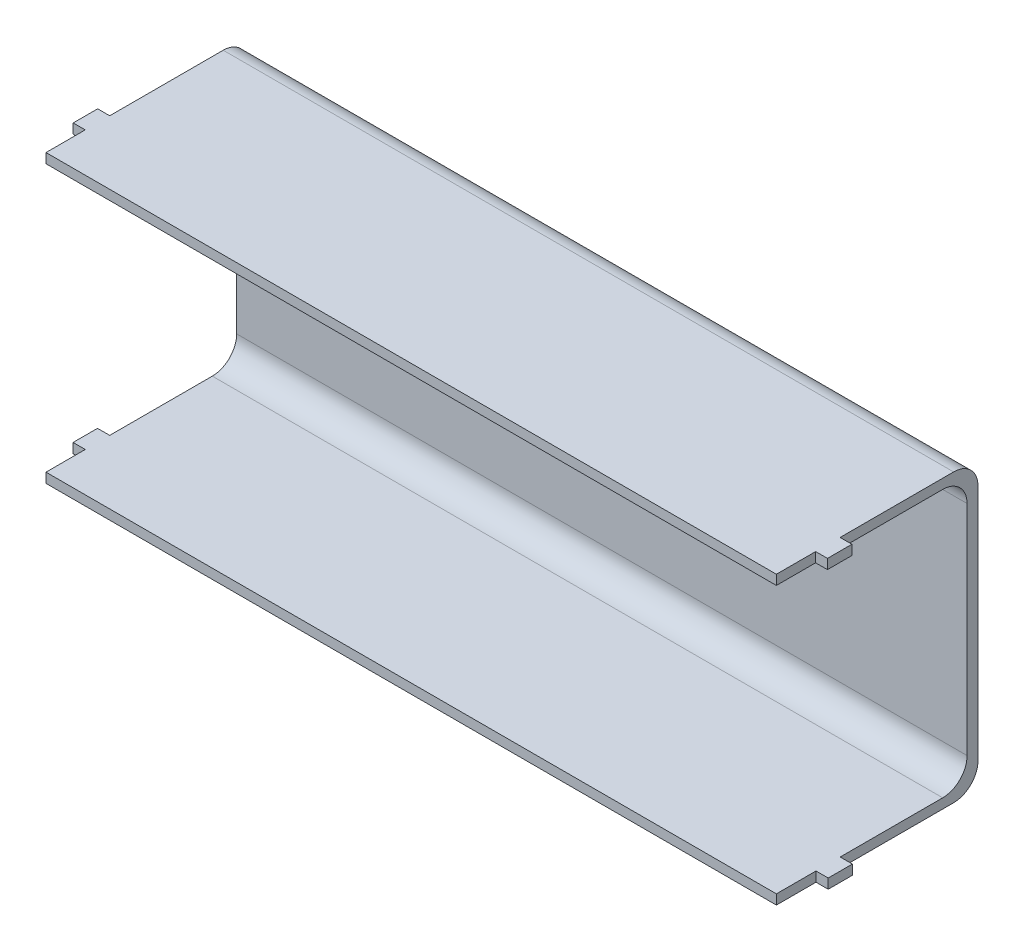
from build123d import *

# Parameters (mm, degrees)
BOSS_EXTRUDE1_DEPTH = 152.146
SKETCH2_W           = 2.509536254
SKETCH2_H           = 5.091968042
SKETCH2_W_2         = 2.457399938
BOSS_EXTRUDE2_DEPTH = 2.032
SKETCH3_W           = 5.037993656
SKETCH3_H           = 2.032
BOSS_EXTRUDE3_DEPTH = 2.54
SKETCH4_W           = 5.091968042
SKETCH4_H           = 2.032
BOSS_EXTRUDE4_DEPTH = 2.54


with BuildPart() as part:
    # Sketch1 → Boss-Extrude1 (new body)
    with BuildSketch(Plane(origin=(0, 0, 0), x_dir=(0, 0, -1), z_dir=(1, 0, 0))):
        with BuildLine():
            Line((0, 42.142112298), (36.917745163, 42.142112298))
            ThreePointArc((36.917745163, 42.142112298), (40.509847611, 40.654214746), (41.997745163, 37.062112298))
            Line((41.997745163, 37.062112298), (41.997745163, -12.467887702))
            ThreePointArc((41.997745163, -12.467887702), (40.509847611, -16.05999015), (36.917745163, -17.547887702))
            Line((36.917745163, -17.547887702), (0, -17.547887702))
            Line((0, -17.547887702), (0, -15.515887702))
            Line((0, -15.515887702), (34.644615501, -15.515887702))
            ThreePointArc((34.644615501, -15.515887702), (38.23671795, -14.02799015), (39.724615501, -10.435887702))
            Line((39.724615501, -10.435887702), (39.724615501, 35.036686341))
            ThreePointArc((39.724615501, 35.036686341), (38.23671795, 38.628788789), (34.644615501, 40.116686341))
            Line((34.644615501, 40.116686341), (0, 40.116686341))
            Line((0, 40.116686341), (0, 42.142112298))
        make_face()
    extrude(amount=-BOSS_EXTRUDE1_DEPTH)

    # Sketch2 → Boss-Extrude2 (add)
    with BuildSketch(Plane(origin=(0, 42.142112298, 0), x_dir=(1, 0, 0), z_dir=(0, 1, 0))):
        with Locations((-153.400768127, 10.723169707)):
            Rectangle(SKETCH2_W, SKETCH2_H)
        with Locations((1.228699969, 10.723169707)):
            Rectangle(SKETCH2_W_2, SKETCH2_H)
    extrude(amount=-BOSS_EXTRUDE2_DEPTH)

    # Sketch3 → Boss-Extrude3 (add)
    with BuildSketch(Plane(origin=(0, 0, 0), x_dir=(0, 0, -1), z_dir=(1, 0, 0))):
        with Locations((10.77174546, -16.531887702)):
            Rectangle(SKETCH3_W, SKETCH3_H)
    extrude(amount=BOSS_EXTRUDE3_DEPTH)

    # Sketch4 → Boss-Extrude4 (add)
    with BuildSketch(Plane.ZY.offset(152.146)):
        with Locations((-10.723169707, -16.531887702)):
            Rectangle(SKETCH4_W, SKETCH4_H)
    extrude(amount=BOSS_EXTRUDE4_DEPTH)


solid = part.part
